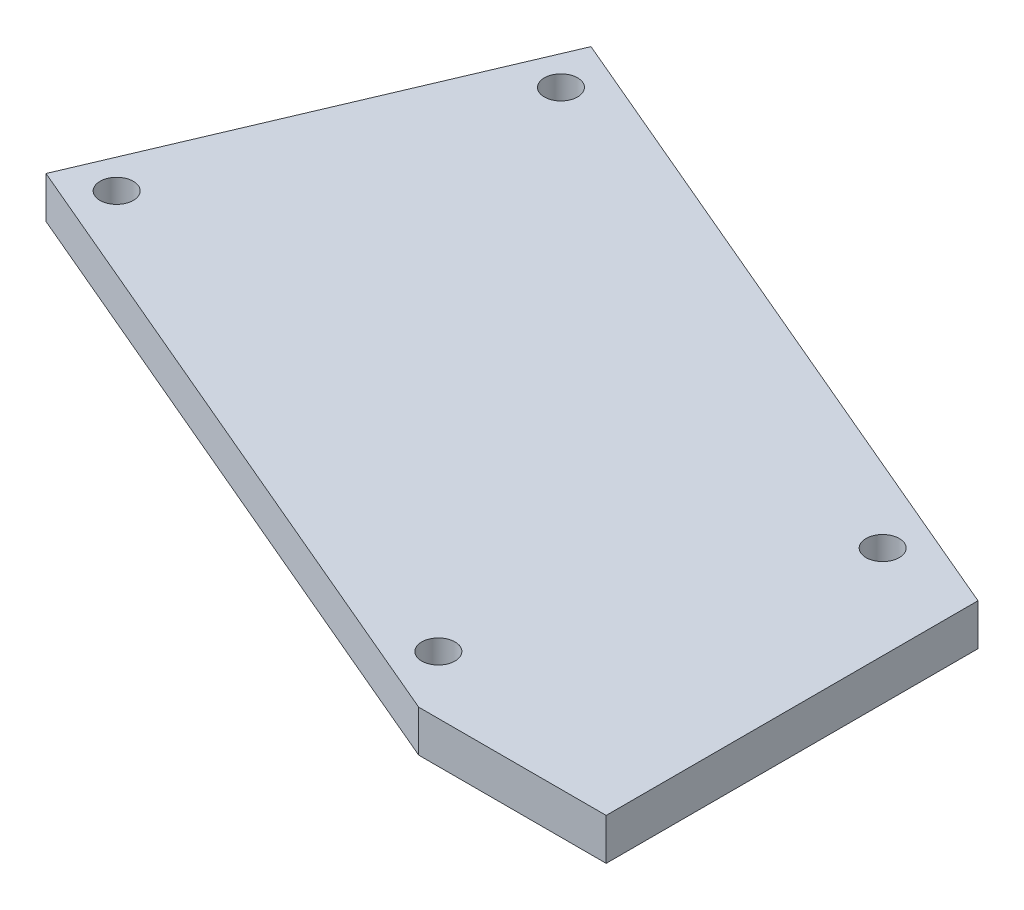
from build123d import *

# Parameters (mm, degrees)
SKETCH1_R           = 1.27
BOSS_EXTRUDE1_DEPTH = 3.175


with BuildPart() as part:
    # Sketch1 → Boss-Extrude1 (new body)
    with BuildSketch(Plane(origin=(0, 0, 0), x_dir=(1, 0, 0), z_dir=(0, 1, 0))):
        Polygon((0, 0), (-51.450921593, 21.881601753), (-63.876832212, -7.335845865), (-14.324041053, -28.410190275), (0, -28.410190275), align=None)
        with Locations(Location((-49.899383574, 18.033755451, 0), (0, 0, 270))):
            Circle(SKETCH1_R, mode=Mode.SUBTRACT)
        with Locations(Location((-60.028985911, -5.784307846, 0), (0, 0, 270))):
            Circle(SKETCH1_R, mode=Mode.SUBTRACT)
        with Locations(Location((-17.257741053, -23.974523249, 0), (0, 0, 270))):
            Circle(SKETCH1_R, mode=Mode.SUBTRACT)
        with Locations(Location((-7.128138716, -0.156459951, 0), (0, 0, 270))):
            Circle(SKETCH1_R, mode=Mode.SUBTRACT)
    extrude(amount=BOSS_EXTRUDE1_DEPTH)


solid = part.part
